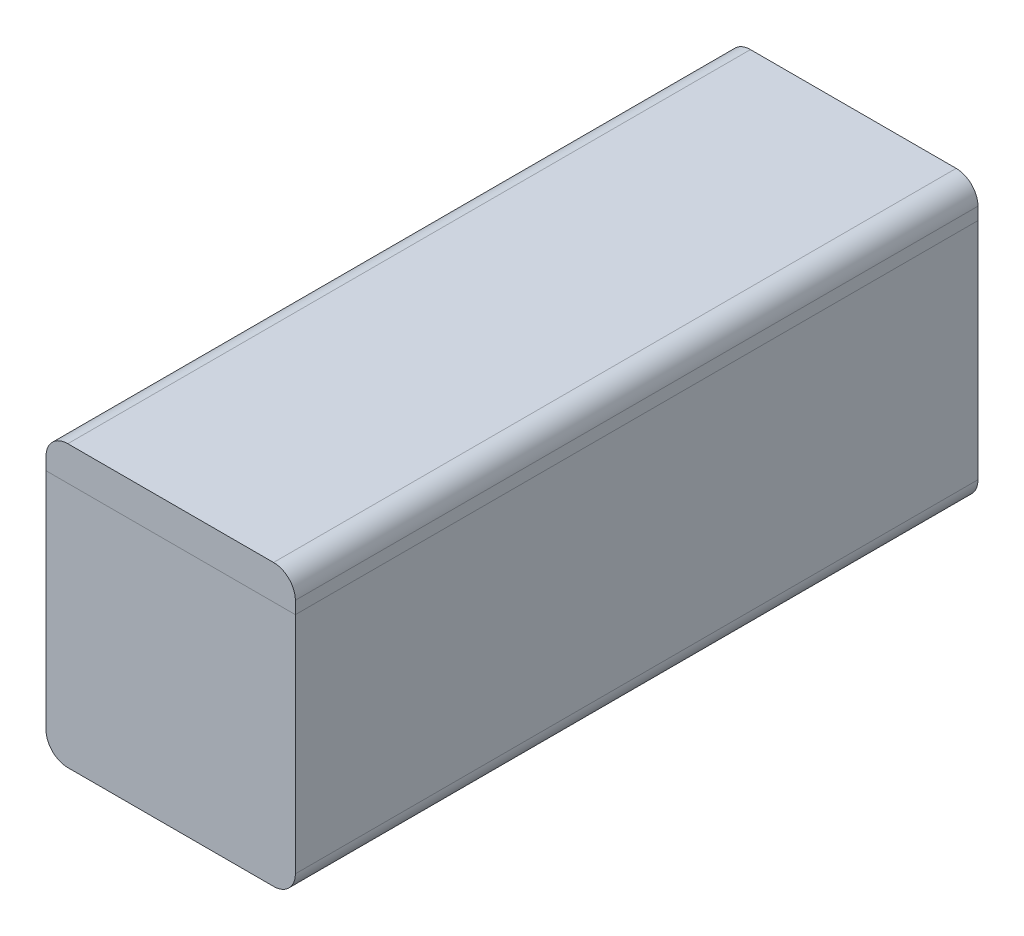
from build123d import *

# Parameters (mm, degrees)
BOSS_EXTRUDE1_DEPTH    = 219
SHELL1_T               = 2
SPLIT1_SURFACE_1_BACK  = 250.922
SPLIT1_SURFACE_1_DEPTH = 501.844
SPLIT1_SURFACE_2_BACK  = 250.922
SPLIT1_SURFACE_2_DEPTH = 501.844


with BuildPart() as part:
    # Sketch2 → Boss-Extrude1 (new body)
    with BuildSketch(Plane.XY):
        with BuildLine():
            Line((7, 0), (73, 0))
            ThreePointArc((73, 0), (77.949747468, 2.050252532), (80, 7))
            Line((80, 7), (80, 83))
            ThreePointArc((80, 83), (77.949747468, 87.949747468), (73, 90))
            Line((73, 90), (7, 90))
            ThreePointArc((7, 90), (2.050252532, 87.949747468), (0, 83))
            Line((0, 83), (0, 7))
            ThreePointArc((0, 7), (2.050252532, 2.050252532), (7, 0))
        make_face()
    extrude(amount=-BOSS_EXTRUDE1_DEPTH)

    # Shell1 (no face opened: a closed hollow body)
    add(offset(amount=-SHELL1_T, mode=Mode.PRIVATE), mode=Mode.SUBTRACT)


with BuildPart() as body_2:
    # Split1: the piece behind the surface
    add(part.part)
    # Split1 surface: a surface, the sketch's curves swept straight by 501.844 mm
    with BuildLine(Plane.XY.offset(-SPLIT1_SURFACE_1_BACK), mode=Mode.PRIVATE) as split1_surface_1_path:
        Line((0, 79), (80, 79))
    split1_surface_1 = Shell.extrude(split1_surface_1_path.wire(), (0 * SPLIT1_SURFACE_1_DEPTH, 0 * SPLIT1_SURFACE_1_DEPTH, 1 * SPLIT1_SURFACE_1_DEPTH))
    split(bisect_by=split1_surface_1, keep=Keep.BOTTOM)


with BuildPart() as part_1:
    add(part.part)

    # Split1: split by a surface, the side it looks to stays
    # Split1 surface: a surface, the sketch's curves swept straight by 501.844 mm
    with BuildLine(Plane.XY.offset(-SPLIT1_SURFACE_2_BACK), mode=Mode.PRIVATE) as split1_surface_2_path:
        Line((0, 79), (80, 79))
    split1_surface_2 = Shell.extrude(split1_surface_2_path.wire(), (0 * SPLIT1_SURFACE_2_DEPTH, 0 * SPLIT1_SURFACE_2_DEPTH, 1 * SPLIT1_SURFACE_2_DEPTH))
    split(bisect_by=split1_surface_2, keep=Keep.TOP)


solid = Compound([body_2.part, part_1.part])
